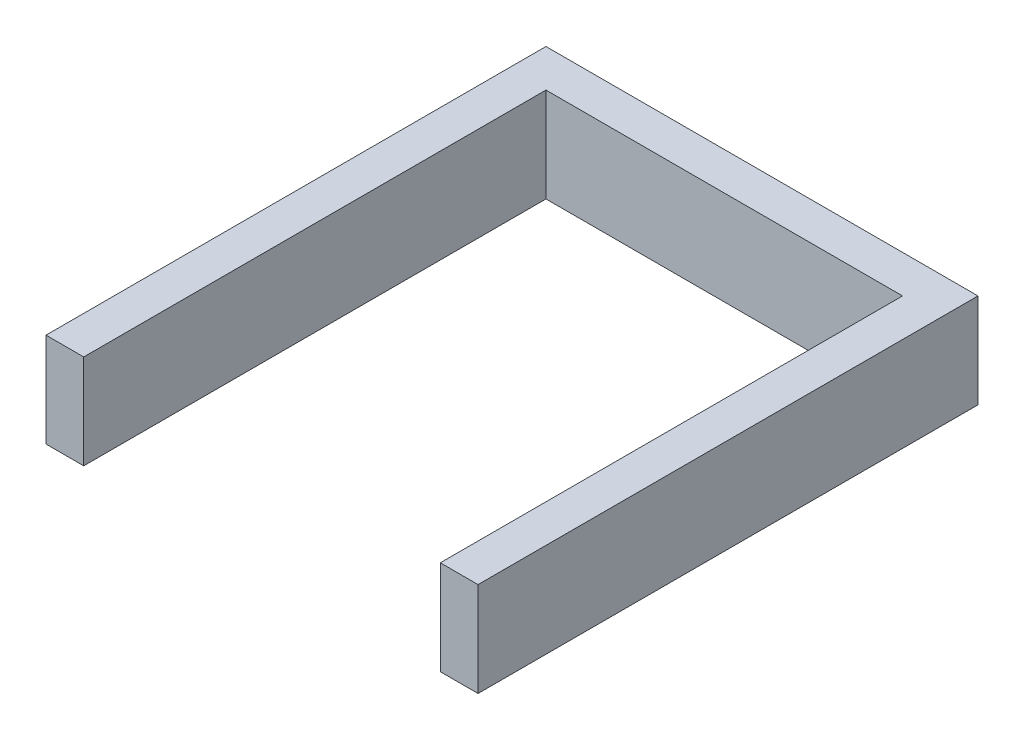
from build123d import *

# Parameters (mm, degrees)
BOSS_EXTRUDE1_DEPTH = 5


with BuildPart() as part:
    # Sketch2 → Boss-Extrude1 (new body)
    with BuildSketch(Plane(origin=(0, 0, 0), x_dir=(1, 0, 0), z_dir=(0, 1, 0))):
        Polygon((-2, 0), (-2, 26.5), (20.9, 26.5), (20.9, 0), (18.9, 0), (18.9, 24.5), (0, 24.5), (0, 0), align=None)
    extrude(amount=BOSS_EXTRUDE1_DEPTH)


solid = part.part
